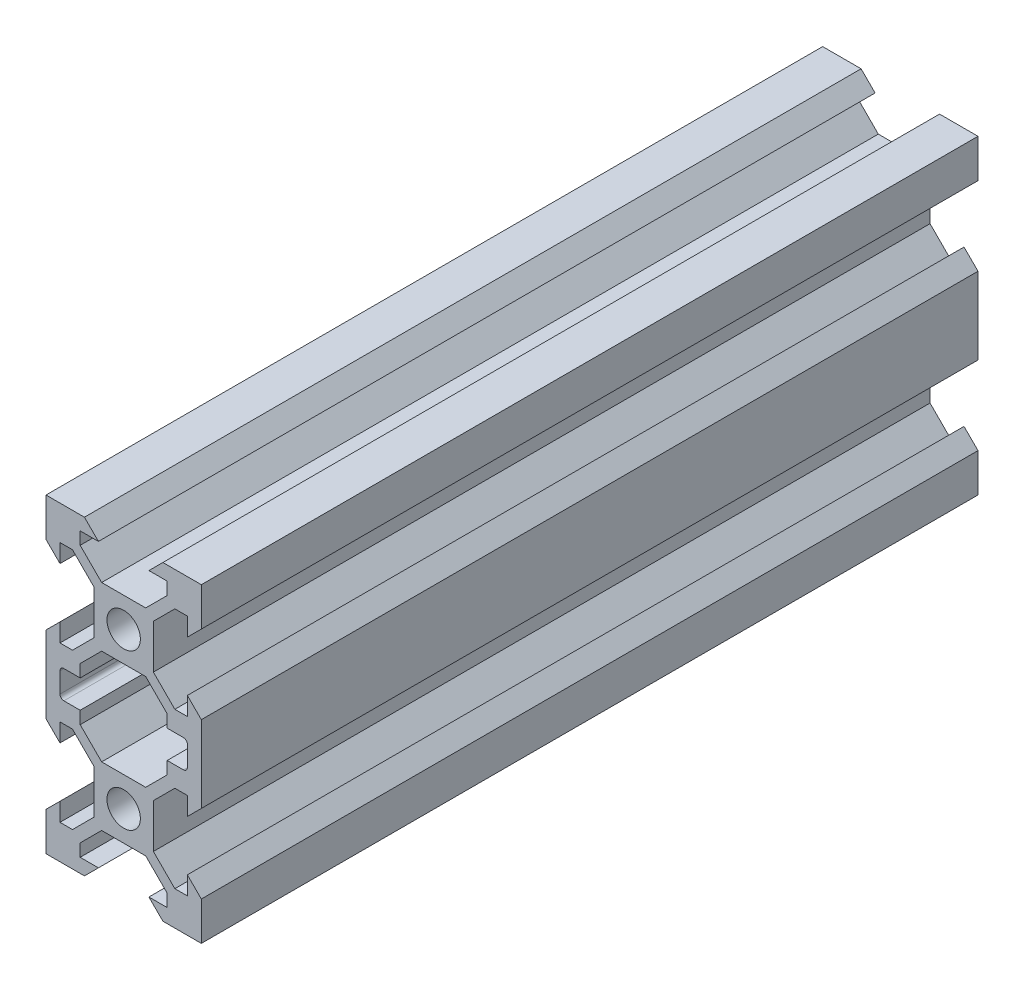
from build123d import *

# Parameters (mm, degrees)
CROQUIS1_R              = 2.15
SALIENTE_EXTRUIR1_DEPTH = 100


with BuildPart() as part:
    # Croquis1 → Saliente-Extruir1 (new body)
    with BuildSketch(Plane.XY):
        Polygon((20, 4.95), (18.2, 6.75), (18.2, 4.4), (16.589949494, 4.4), (13.825, 7.164949494), (13.825, 12.835050506), (16.589949494, 15.6), (18.2, 15.6), (18.2, 13.25), (20, 15.05), (20, 20), (15.05, 20), (13.25, 18.2), (15.6, 18.2), (15.6, 16.589949494), (12.835050506, 13.825), (7.164949494, 13.825), (4.4, 16.589949494), (4.4, 18.2), (6.75, 18.2), (4.95, 20), (0, 20), (0, 15.05), (1.8, 13.25), (1.8, 15.6), (3.410050506, 15.6), (6.175, 12.835050506), (6.175, 7.164949494), (3.410050506, 4.4), (1.8, 4.4), (1.8, 6.75), (0, 4.95), (0, -4.95), (1.8, -6.75), (1.8, -4.4), (3.410050506, -4.4), (6.175, -7.164949494), (6.175, -12.835050506), (3.410050506, -15.6), (1.8, -15.6), (1.8, -13.25), (0, -15.05), (0, -20), (4.95, -20), (6.75, -18.2), (4.4, -18.2), (4.4, -16.589949494), (7.164949494, -13.825), (12.835050506, -13.825), (15.6, -16.589949494), (15.6, -18.2), (13.25, -18.2), (15.05, -20), (20, -20), (20, -15.05), (18.2, -13.25), (18.2, -15.6), (16.589949494, -15.6), (13.825, -12.835050506), (13.825, -7.164949494), (16.589949494, -4.4), (18.2, -4.4), (18.2, -6.75), (20, -4.95), align=None)
        with BuildLine():
            Line((1.8, -1.3), (1.8, 1.3))
            ThreePointArc((1.8, 1.3), (1.946446609, 1.653553391), (2.3, 1.8))
            Line((2.3, 1.8), (4.4, 1.8))
            Line((4.4, 1.8), (4.4, 3.410050506))
            Line((4.4, 3.410050506), (7.164949494, 6.175))
            Line((7.164949494, 6.175), (12.835050506, 6.175))
            Line((12.835050506, 6.175), (15.6, 3.410050506))
            Line((15.6, 3.410050506), (15.6, 1.8))
            Line((15.6, 1.8), (17.7, 1.8))
            ThreePointArc((17.7, 1.8), (18.053553391, 1.653553391), (18.2, 1.3))
            Line((18.2, 1.3), (18.2, -1.3))
            ThreePointArc((18.2, -1.3), (18.053553391, -1.653553391), (17.7, -1.8))
            Line((17.7, -1.8), (15.6, -1.8))
            Line((15.6, -1.8), (15.6, -3.410050506))
            Line((15.6, -3.410050506), (12.835050506, -6.175))
            Line((12.835050506, -6.175), (7.164949494, -6.175))
            Line((7.164949494, -6.175), (4.4, -3.410050506))
            Line((4.4, -3.410050506), (4.4, -1.8))
            Line((4.4, -1.8), (2.3, -1.8))
            ThreePointArc((2.3, -1.8), (1.946446609, -1.653553391), (1.8, -1.3))
        make_face(mode=Mode.SUBTRACT)
        with Locations((10, -10)):
            Circle(CROQUIS1_R, mode=Mode.SUBTRACT)
        with Locations((10, 10)):
            Circle(CROQUIS1_R, mode=Mode.SUBTRACT)
    extrude(amount=SALIENTE_EXTRUIR1_DEPTH)


solid = part.part
